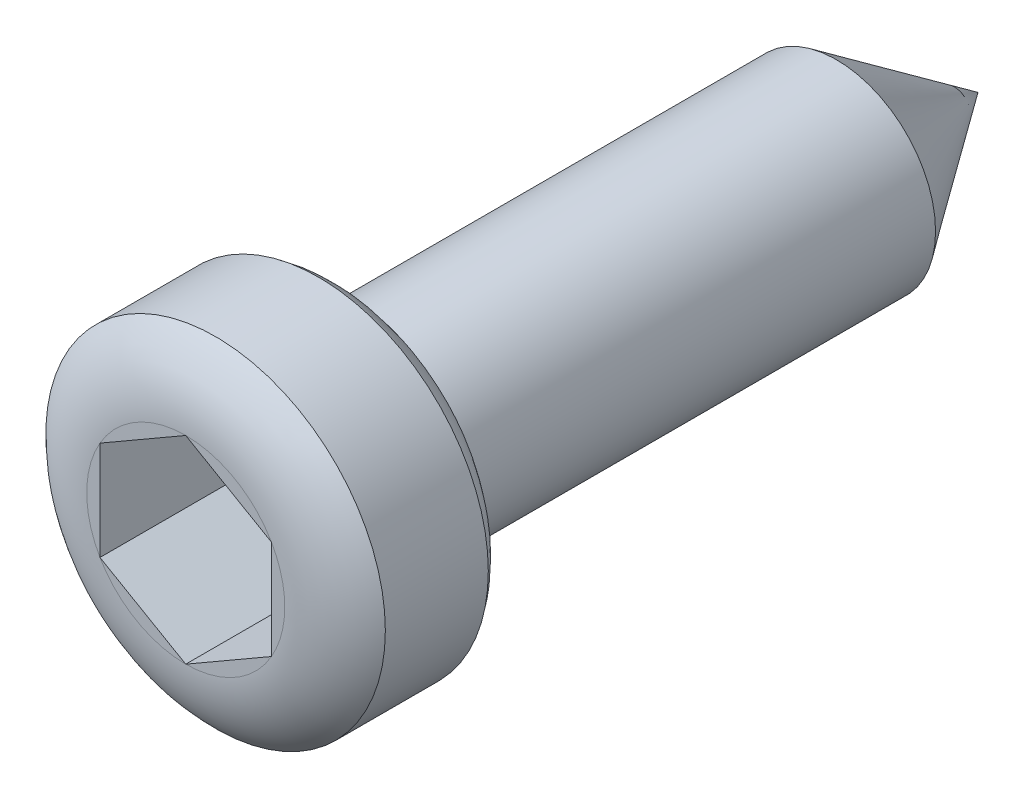
from build123d import *

# Parameters (mm, degrees)
CUT_EXTRUDE1_DEPTH = 2.5


with BuildPart() as part:
    # Sketch1 → Revolve1 (revolve)
    with BuildSketch(Plane(origin=(0, 0, 0), x_dir=(0, 0, -1), z_dir=(1, 0, 0)), mode=Mode.PRIVATE) as revolve1_sk:
        with BuildLine():
            Line((0, 0), (14, 0))
            Line((14, 0), (11.5, 1.75))
            Line((11.5, 1.75), (3.017689414, 1.75))
            ThreePointArc((3.017689414, 1.75), (2.839380432, 2.459318583), (2.346845612, 3))
            Line((2.346845612, 3), (0.527441756, 3))
            ThreePointArc((0.527441756, 3), (0.137258951, 2.428361041), (0, 1.75))
            Line((0, 1.75), (0, 0))
        make_face()
    revolve(revolve1_sk.sketch.rotate(Axis((0, 0, 0), (0, 0, -1)), 90), axis=Axis((0, 0, 0), (0, 0, -1)))

    # Sketch7 → Cut-Extrude1 (cut)
    with BuildSketch(Plane.XY):
        Polygon((-1.515544457, 0.875), (-1.515544457, -0.875), (0, -1.75), (1.515544457, -0.875), (1.515544457, 0.875), (0, 1.75), align=None)
    extrude(amount=-CUT_EXTRUDE1_DEPTH, mode=Mode.SUBTRACT)


solid = part.part
